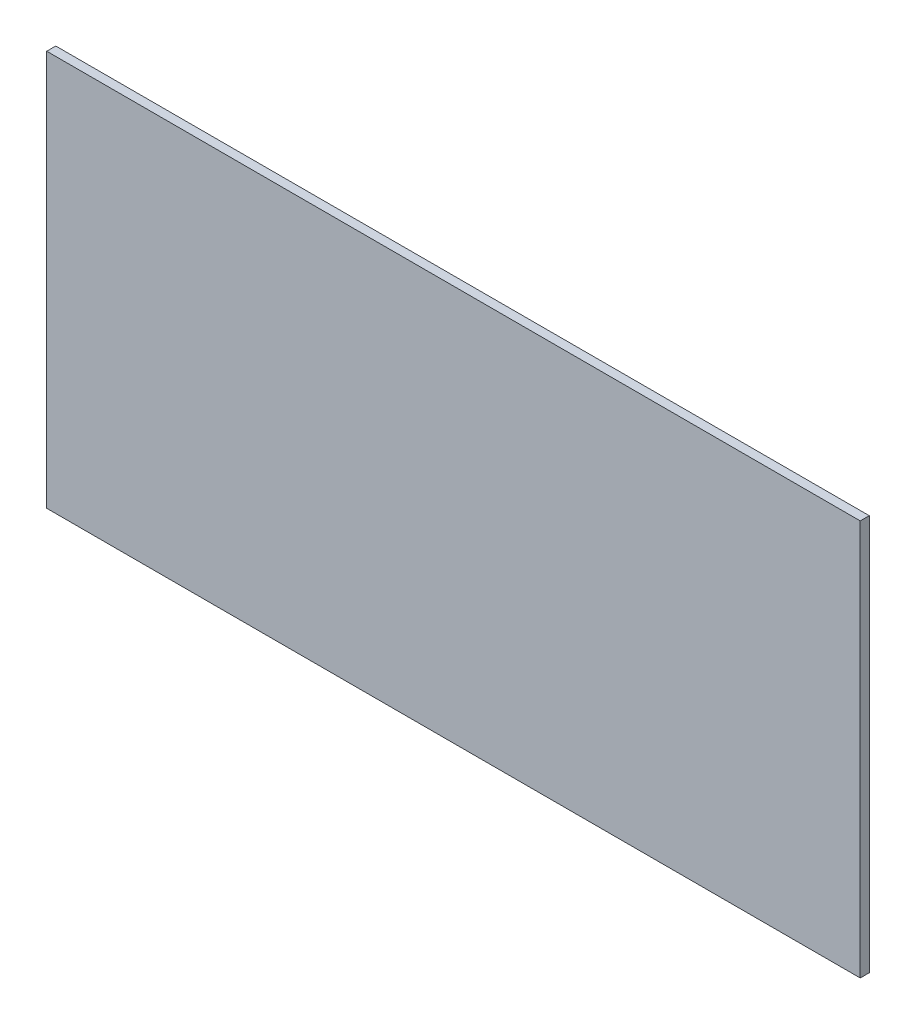
from build123d import *

# Parameters (mm, degrees)
SKETCH1_W           = 142.941176471
SKETCH1_H           = 69.558823529
BOSS_EXTRUDE1_DEPTH = 1.5875


with BuildPart() as part:
    # Sketch1 → Boss-Extrude1 (new body)
    with BuildSketch(Plane.XY):
        with Locations((71.470588236, 34.779411765)):
            Rectangle(SKETCH1_W, SKETCH1_H)
    extrude(amount=BOSS_EXTRUDE1_DEPTH)


solid = part.part
